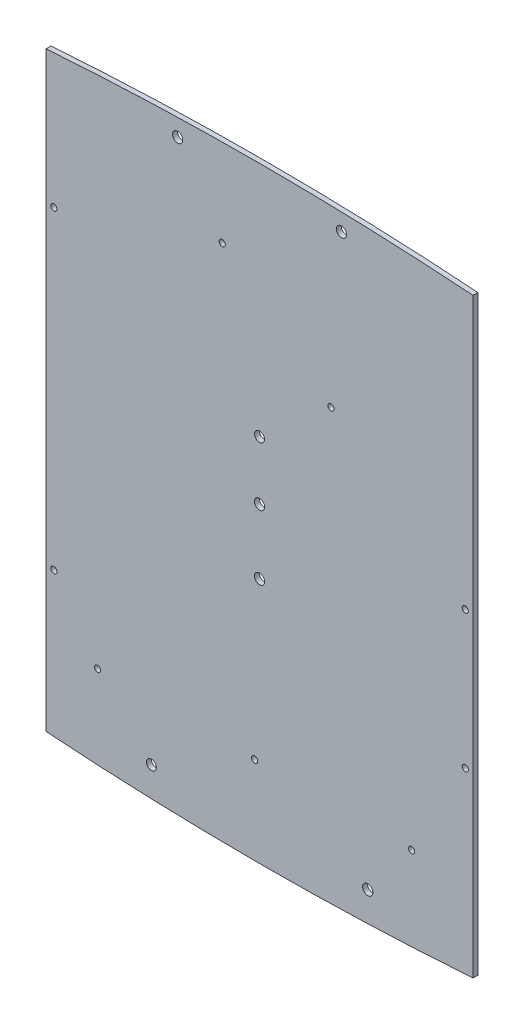
from build123d import *

# Parameters (mm, degrees)
SKETCH1_R      = 2
SKETCH1_R_2    = 3.3
SKETCH1_R_3    = 3.2
EXTRUDE1_DEPTH = 3.175


with BuildPart() as part:
    # Sketch1 → Extrude1 (new body)
    with BuildSketch(Plane.XY):
        with BuildLine():
            Line((138.1125, 191.25), (138.1125, -191.25))
            ThreePointArc((138.1125, -191.25), (0, -196.183512306), (-138.1125, -191.25))
            Line((-138.1125, -191.25), (-138.1125, 191.25))
            ThreePointArc((-138.1125, 191.25), (0, 196.183512306), (138.1125, 191.25))
        make_face()
        with Locations((46.1772, 82.55)):
            Circle(SKETCH1_R, mode=Mode.SUBTRACT)
        with Locations((53, 184.28)):
            Circle(SKETCH1_R_2, mode=Mode.SUBTRACT)
        with Locations((-24.13, 139.446)):
            Circle(SKETCH1_R, mode=Mode.SUBTRACT)
        with Locations((-133.096, 104.936568767)):
            Circle(SKETCH1_R, mode=Mode.SUBTRACT)
        with Locations((-53, 184.28)):
            Circle(SKETCH1_R_2, mode=Mode.SUBTRACT)
        with Locations((0, 43)):
            Circle(SKETCH1_R_3, mode=Mode.SUBTRACT)
        with Locations((0, 5.15)):
            Circle(SKETCH1_R_2, mode=Mode.SUBTRACT)
        with Locations((0, -36.65)):
            Circle(SKETCH1_R_2, mode=Mode.SUBTRACT)
        with Locations((133.096, 12.7)):
            Circle(SKETCH1_R, mode=Mode.SUBTRACT)
        with Locations((133.096, -76.2)):
            Circle(SKETCH1_R, mode=Mode.SUBTRACT)
        with Locations((98.425, -139.446)):
            Circle(SKETCH1_R, mode=Mode.SUBTRACT)
        with Locations((70, -175.85)):
            Circle(SKETCH1_R_2, mode=Mode.SUBTRACT)
        with Locations((-3.175, -139.446)):
            Circle(SKETCH1_R, mode=Mode.SUBTRACT)
        with Locations((-133.096, -98.263431233)):
            Circle(SKETCH1_R, mode=Mode.SUBTRACT)
        with Locations((-104.775, -139.446)):
            Circle(SKETCH1_R, mode=Mode.SUBTRACT)
        with Locations((-70, -175.85)):
            Circle(SKETCH1_R_3, mode=Mode.SUBTRACT)
    extrude(amount=EXTRUDE1_DEPTH)


solid = part.part
